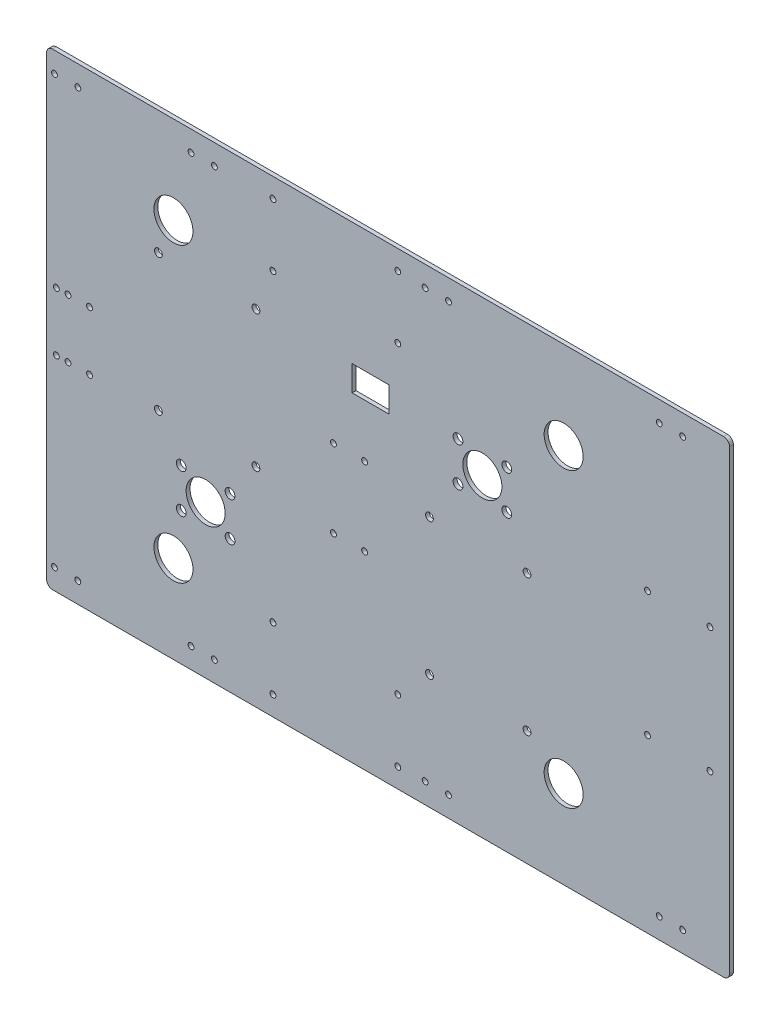
from build123d import *

# Parameters (mm, degrees)
MODEL_R         = 1.5
MODEL_R_2       = 10
MODEL_R_3       = 2
MODEL_R_4       = 2.5
MODEL_W         = 19
MODEL_H         = 13
EXTRUDE_1_DEPTH = 2


with BuildPart() as part:
    # Model → 凸台-拉伸1 (new body)
    with BuildSketch(Plane.XY):
        with BuildLine():
            Line((347, 120), (3, 120))
            ThreePointArc((3, 120), (0.878679656, 119.121320344), (0, 117))
            Line((0, 117), (0, -117))
            ThreePointArc((0, -117), (0.878679656, -119.121320344), (3, -120))
            Line((3, -120), (347, -120))
            ThreePointArc((347, -120), (349.121320344, -119.121320344), (350, -117))
            Line((350, -117), (350, 117))
            ThreePointArc((350, 117), (349.121320344, 119.121320344), (347, 120))
        make_face()
        with Locations((4, 109.5)):
            Circle(MODEL_R, mode=Mode.SUBTRACT)
        with Locations((16, 109.5)):
            Circle(MODEL_R, mode=Mode.SUBTRACT)
        with Locations((74, 109.5)):
            Circle(MODEL_R, mode=Mode.SUBTRACT)
        with Locations((86, 109.5)):
            Circle(MODEL_R, mode=Mode.SUBTRACT)
        with Locations((194, 109.5)):
            Circle(MODEL_R, mode=Mode.SUBTRACT)
        with Locations((206, 109.5)):
            Circle(MODEL_R, mode=Mode.SUBTRACT)
        with Locations((314, 109.5)):
            Circle(MODEL_R, mode=Mode.SUBTRACT)
        with Locations((326, 109.5)):
            Circle(MODEL_R, mode=Mode.SUBTRACT)
        with Locations((5, 15)):
            Circle(MODEL_R, mode=Mode.SUBTRACT)
        with Locations((22, 15)):
            Circle(MODEL_R, mode=Mode.SUBTRACT)
        with Locations((147, 17)):
            Circle(MODEL_R, mode=Mode.SUBTRACT)
        with Locations((163, 17)):
            Circle(MODEL_R, mode=Mode.SUBTRACT)
        with Locations((308, 32)):
            Circle(MODEL_R, mode=Mode.SUBTRACT)
        with Locations((340, 32)):
            Circle(MODEL_R, mode=Mode.SUBTRACT)
        with Locations((147, -23)):
            Circle(MODEL_R, mode=Mode.SUBTRACT)
        with Locations((163, -23)):
            Circle(MODEL_R, mode=Mode.SUBTRACT)
        with Locations((340, -32)):
            Circle(MODEL_R, mode=Mode.SUBTRACT)
        with Locations((308, -32)):
            Circle(MODEL_R, mode=Mode.SUBTRACT)
        with Locations((5, -15)):
            Circle(MODEL_R, mode=Mode.SUBTRACT)
        with Locations((22, -15)):
            Circle(MODEL_R, mode=Mode.SUBTRACT)
        with Locations((326, -109.5)):
            Circle(MODEL_R, mode=Mode.SUBTRACT)
        with Locations((314, -109.5)):
            Circle(MODEL_R, mode=Mode.SUBTRACT)
        with Locations((206, -109.5)):
            Circle(MODEL_R, mode=Mode.SUBTRACT)
        with Locations((194, -109.5)):
            Circle(MODEL_R, mode=Mode.SUBTRACT)
        with Locations((4, -109.5)):
            Circle(MODEL_R, mode=Mode.SUBTRACT)
        with Locations((16, -109.5)):
            Circle(MODEL_R, mode=Mode.SUBTRACT)
        with Locations((86, -109.5)):
            Circle(MODEL_R, mode=Mode.SUBTRACT)
        with Locations((74, -109.5)):
            Circle(MODEL_R, mode=Mode.SUBTRACT)
        with Locations((116, 110)):
            Circle(MODEL_R, mode=Mode.SUBTRACT)
        with Locations((180, 110)):
            Circle(MODEL_R, mode=Mode.SUBTRACT)
        with Locations((180, 78)):
            Circle(MODEL_R, mode=Mode.SUBTRACT)
        with Locations((116, 78)):
            Circle(MODEL_R, mode=Mode.SUBTRACT)
        with Locations((116, -110)):
            Circle(MODEL_R, mode=Mode.SUBTRACT)
        with Locations((116, -78)):
            Circle(MODEL_R, mode=Mode.SUBTRACT)
        with Locations((180, -110)):
            Circle(MODEL_R, mode=Mode.SUBTRACT)
        with Locations((180, -78)):
            Circle(MODEL_R, mode=Mode.SUBTRACT)
        with Locations((65, 75)):
            Circle(MODEL_R_2, mode=Mode.SUBTRACT)
        with Locations((265, 75)):
            Circle(MODEL_R_2, mode=Mode.SUBTRACT)
        with Locations((65, -75)):
            Circle(MODEL_R_2, mode=Mode.SUBTRACT)
        with Locations((265, -75)):
            Circle(MODEL_R_2, mode=Mode.SUBTRACT)
        with Locations((196.233121438, 8.98763143)):
            Circle(MODEL_R_3, mode=Mode.SUBTRACT)
        with Locations((246.233121438, 8.98763143)):
            Circle(MODEL_R_3, mode=Mode.SUBTRACT)
        with Locations((246.233121438, -61.01236857)):
            Circle(MODEL_R_3, mode=Mode.SUBTRACT)
        with Locations((196.233121438, -61.01236857)):
            Circle(MODEL_R_3, mode=Mode.SUBTRACT)
        with Locations((57.291145141, 56.742657586)):
            Circle(MODEL_R_3, mode=Mode.SUBTRACT)
        with Locations((107.291145141, 56.742657586)):
            Circle(MODEL_R_3, mode=Mode.SUBTRACT)
        with Locations((107.291145141, -13.257342414)):
            Circle(MODEL_R_3, mode=Mode.SUBTRACT)
        with Locations((57.291145141, -13.257342414)):
            Circle(MODEL_R_3, mode=Mode.SUBTRACT)
        with Locations((223.356321923, 40.866493507)):
            Circle(MODEL_R_2, mode=Mode.SUBTRACT)
        with Locations((235.856321923, 50.866493507)):
            Circle(MODEL_R_4, mode=Mode.SUBTRACT)
        with Locations((235.856321923, 30.866493507)):
            Circle(MODEL_R_4, mode=Mode.SUBTRACT)
        with Locations((210.856321923, 50.866493507)):
            Circle(MODEL_R_4, mode=Mode.SUBTRACT)
        with Locations((210.856321923, 30.866493507)):
            Circle(MODEL_R_4, mode=Mode.SUBTRACT)
        with Locations((81.50395009, -41.835014451)):
            Circle(MODEL_R_2, mode=Mode.SUBTRACT)
        with Locations((94.00395009, -31.835014451)):
            Circle(MODEL_R_4, mode=Mode.SUBTRACT)
        with Locations((94.00395009, -51.835014451)):
            Circle(MODEL_R_4, mode=Mode.SUBTRACT)
        with Locations((69.00395009, -31.835014451)):
            Circle(MODEL_R_4, mode=Mode.SUBTRACT)
        with Locations((69.00395009, -51.835014451)):
            Circle(MODEL_R_4, mode=Mode.SUBTRACT)
        with Locations((11, 15)):
            Circle(MODEL_R, mode=Mode.SUBTRACT)
        with Locations(Location((11, -15, 0), (0, 0, 180))):
            Circle(MODEL_R, mode=Mode.SUBTRACT)
        with Locations((166.089590214, 50.675703705)):
            Rectangle(MODEL_W, MODEL_H, mode=Mode.SUBTRACT)
    extrude(amount=EXTRUDE_1_DEPTH)


solid = part.part
